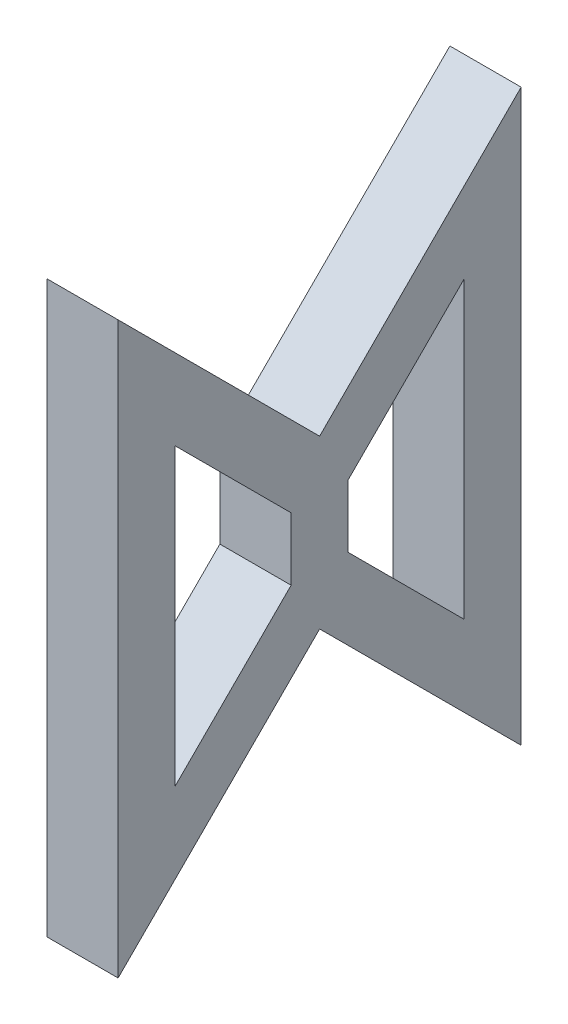
from build123d import *

# Parameters (mm, degrees)
BOSS_EXTRUDE1_DEPTH = 5
CUT_EXTRUDE1_DEPTH  = 50.244289009


with BuildPart() as part:
    # Sketch1 → Boss-Extrude1 (new body)
    with BuildSketch(Plane(origin=(0, 0, 0), x_dir=(0, 0, -1), z_dir=(1, 0, 0))):
        Polygon((0, 0), (0, -40), (14.142135624, -25.857864376), (28.284271247, -40), (28.284271247, 0), (14.142135624, -14.142135624), align=None)
    extrude(amount=BOSS_EXTRUDE1_DEPTH)

    # Sketch2 → Cut-Extrude1 (cut, through all)
    with BuildSketch(Plane(origin=(5, 0, 0), x_dir=(0, 0, -1), z_dir=(1, 0, 0))):
        Polygon((4, -30.343145751), (12.142135624, -22.201010127), (12.142135624, -17.798989873), (4, -9.656854249), align=None)
        Polygon((16.142135624, -17.798989873), (16.142135624, -22.201010127), (24.284271247, -30.343145751), (24.284271247, -9.656854249), align=None)
    extrude(amount=-CUT_EXTRUDE1_DEPTH, mode=Mode.SUBTRACT)


solid = part.part
